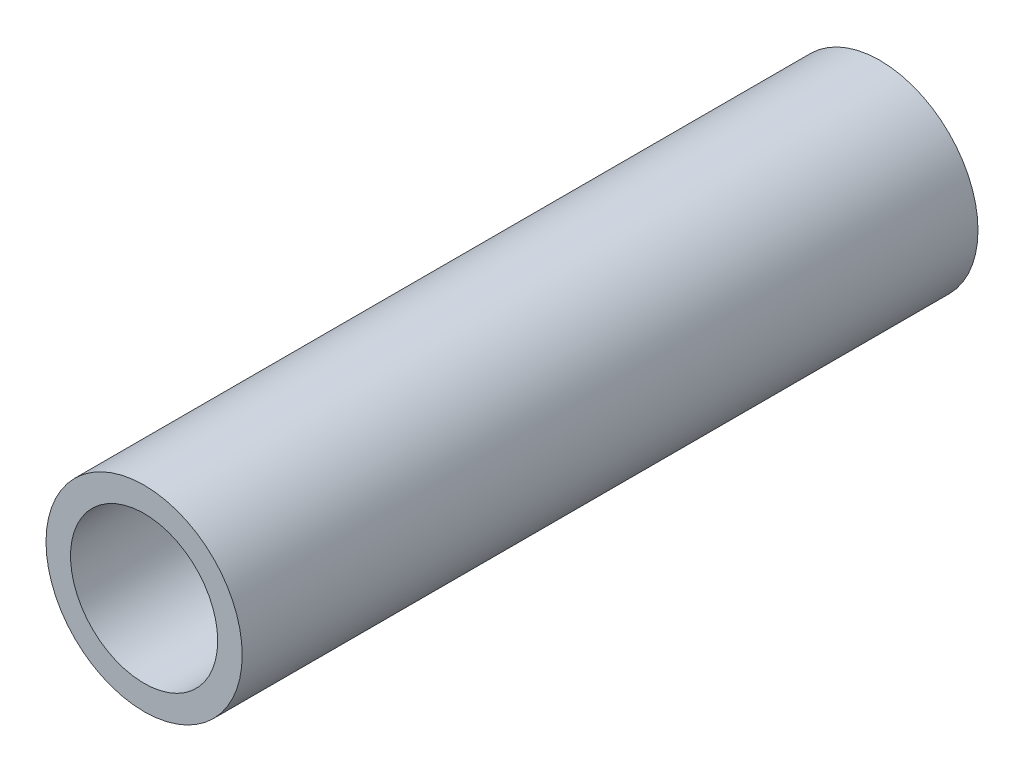
from build123d import *

# Parameters (mm, degrees)
SKIZZE1_R                       = 4
AUFSATZ_LINEAR_AUSTRAGEN1_DEPTH = 30
WANDUNG1_T                      = -1


with BuildPart() as part:
    # Skizze1 → Aufsatz-Linear austragen1 (new body)
    with BuildSketch(Plane.XY):
        Circle(SKIZZE1_R)
    extrude(amount=AUFSATZ_LINEAR_AUSTRAGEN1_DEPTH)

    # Wandung1
    wandung1_openings = [part.faces().sort_by_distance(p)[0] for p in [
        (0, 0, 30),
        (0, 0, 0),
    ]]
    offset(amount=WANDUNG1_T, openings=wandung1_openings, kind=Kind.INTERSECTION)


solid = part.part
